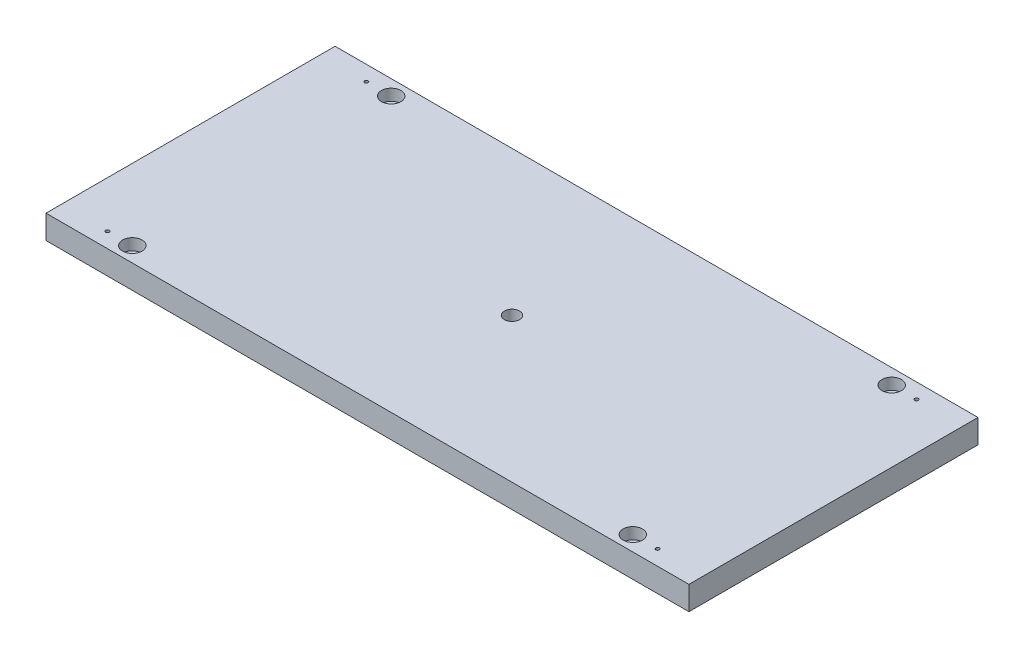
from build123d import *

# Parameters (mm, degrees)
SZKIC1_W                                           = 596
SZKIC1_H                                           = 268
DODANIE_WYCI_GNI_CIE1_DEPTH                        = 22
POG_BIENIE_WALCOWE_POD_M10_WKR_T_Z_BEM_D           = 11
POG_BIENIE_WALCOWE_POD_M10_WKR_T_Z_BEM_CBORE_D     = 18
POG_BIENIE_WALCOWE_POD_M10_WKR_T_Z_BEM_CBORE_DEPTH = 10.6
OTW_R_GWINTOWANY_M41_D                             = 3.3
OTW_R_GWINTOWANY_M41_DEPTH                         = 11.5
OTW_R_GWINTOWANY_M41_TIP                           = 0.991420021
OTW_R_GWINTOWANY_M161_D                            = 14


with BuildPart() as part:
    # Szkic1 → Dodanie-wyciągnięcie1 (new body)
    with BuildSketch(Plane(origin=(0, 0, 0), x_dir=(1, 0, 0), z_dir=(0, 1, 0))):
        with Locations((298, 134)):
            Rectangle(SZKIC1_W, SZKIC1_H)
    extrude(amount=DODANIE_WYCI_GNI_CIE1_DEPTH)

    # Pogłębienie walcowe pod M10 Wkręt z łbem walcowym z gniazdem sześciokątnym1 (through all)
    with Locations(Plane(origin=(66, 22, -254), x_dir=(0, 0, 1), z_dir=(0, 1, 0))):
        with Locations((0, 0), (240, 0), (240, 464), (0, 464)):
            CounterBoreHole(POG_BIENIE_WALCOWE_POD_M10_WKR_T_Z_BEM_D / 2, POG_BIENIE_WALCOWE_POD_M10_WKR_T_Z_BEM_CBORE_D / 2, POG_BIENIE_WALCOWE_POD_M10_WKR_T_Z_BEM_CBORE_DEPTH)

    # Otwór gwintowany M41
    with Locations(Plane(origin=(43, 22, -14), x_dir=(0, 0, 1), z_dir=(0, 1, 0))):
        with Locations((0, 0), (-240, 0), (-240, 510), (0, 510)):
            Hole(OTW_R_GWINTOWANY_M41_D / 2, depth=OTW_R_GWINTOWANY_M41_DEPTH)
            with Locations((0, 0, -(OTW_R_GWINTOWANY_M41_DEPTH + OTW_R_GWINTOWANY_M41_TIP / 2))):  # 118° drill point
                Cone(0, OTW_R_GWINTOWANY_M41_D / 2, OTW_R_GWINTOWANY_M41_TIP, mode=Mode.SUBTRACT)

    # Otwór gwintowany M161 (through all)
    with Locations(Plane(origin=(298, 22, -134), x_dir=(0, 0, 1), z_dir=(0, 1, 0))):
        with Locations((0, 0)):
            Hole(OTW_R_GWINTOWANY_M161_D / 2)


solid = part.part
